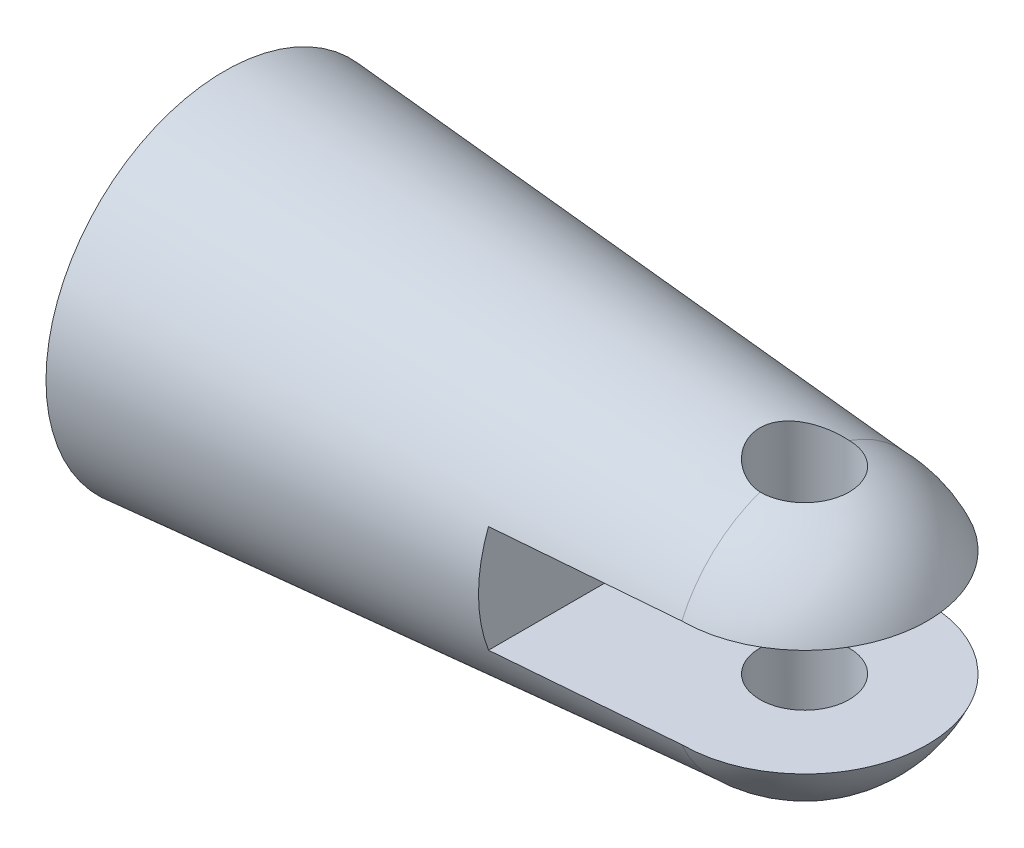
from build123d import *

# Parameters (mm, degrees)
SKETCH2_R           = 5
CUT_EXTRUDE1_DEPTH  = 25
SKETCH3_R           = 8
BOSS_EXTRUDE1_DEPTH = 8
SKETCH4_W           = 40
SKETCH4_H           = 12
CUT_EXTRUDE2_DEPTH  = 20


with BuildPart() as part:
    # Sketch1 → Revolve1 (revolve)
    with BuildSketch(Plane(origin=(0, 0, 0), x_dir=(1, 0, 0), z_dir=(0, 1, 0)), mode=Mode.PRIVATE) as revolve1_sk:
        with BuildLine():
            Line((0, 0), (0, 20))
            Line((0, 20), (65, 15))
            ThreePointArc((65, 15), (75.606601718, 10.606601718), (80, 0))
            Line((80, 0), (0, 0))
        make_face()
    revolve(revolve1_sk.sketch.rotate(Axis((-20.908281483, 0, 0), (1, 0, 0)), 180), axis=Axis((-20.908281483, 0, 0), (1, 0, 0)))

    # Sketch2 → Cut-Extrude1 (cut, symmetric)
    with BuildSketch(Plane(origin=(0, 0, 0), x_dir=(1, 0, 0), z_dir=(0, 1, 0))):
        with Locations(Location((65, 0, 0), (0, 0, 270))):
            Circle(SKETCH2_R)
    extrude(amount=CUT_EXTRUDE1_DEPTH, both=True, mode=Mode.SUBTRACT)

    # Sketch3 → Boss-Extrude1 (add)
    with BuildSketch(Plane.ZY):
        with Locations(Location((0, 0, 0), (0, 0, 180))):
            Circle(SKETCH3_R)
    extrude(amount=BOSS_EXTRUDE1_DEPTH)

    # Sketch4 → Cut-Extrude2 (cut, symmetric)
    with BuildSketch(Plane.XY):
        with Locations((65, 0)):
            Rectangle(SKETCH4_W, SKETCH4_H)
    extrude(amount=CUT_EXTRUDE2_DEPTH, both=True, mode=Mode.SUBTRACT)


solid = part.part
